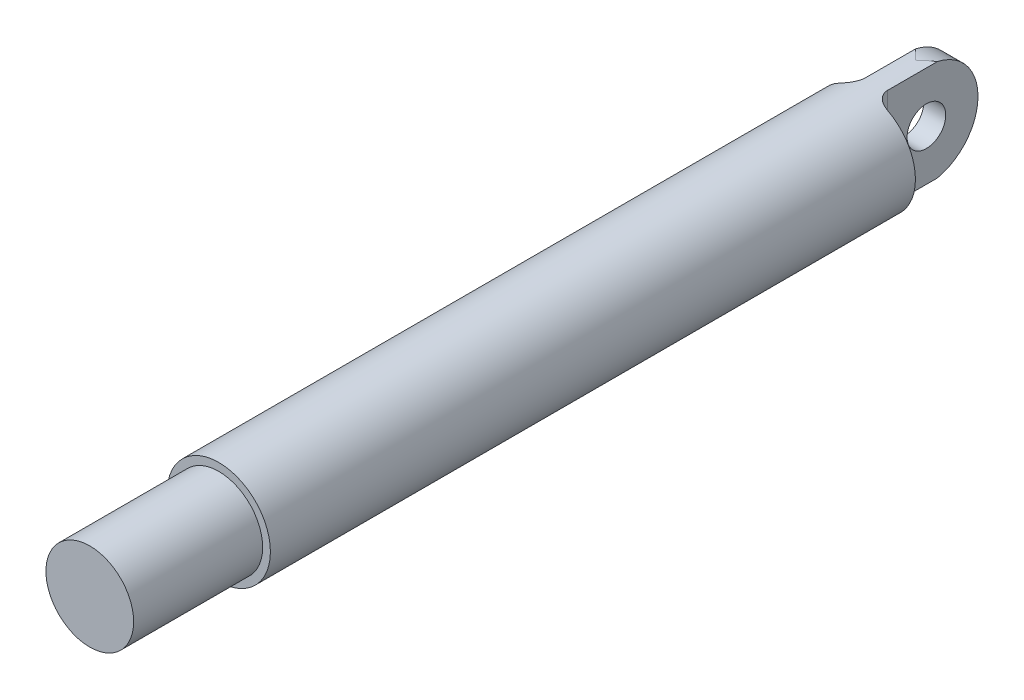
from build123d import *

# Parameters (mm, degrees)
SKETCH5_R               = 20
BOSS_EXTRUDE4_DEPTH     = 250
SKETCH6_R               = 17
BOSS_EXTRUDE5_DEPTH     = 50
SKETCH7_R               = 7.5
BOSS_EXTRUDE6_DEPTH     = 4.25
CUT_EXTRUDE1_DEPTH      = 302.330383466
CUT_EXTRUDE1_DEPTH_BACK = 302.330383466
SKETCH8_OUTSIDE_W       = 110.934
SKETCH8_OUTSIDE_H       = 110.934
SKETCH8_OUTSIDE_R       = 20
FILLET1_R               = 5


with BuildPart() as part:
    # Sketch5 → Boss-Extrude4 (new body)
    with BuildSketch(Plane.XY):
        Circle(SKETCH5_R)
    extrude(amount=-BOSS_EXTRUDE4_DEPTH)

    # Sketch6 → Boss-Extrude5 (add)
    with BuildSketch(Plane.XY):
        Circle(SKETCH6_R)
    extrude(amount=BOSS_EXTRUDE5_DEPTH)

    # Sketch7 → Boss-Extrude6 (add, symmetric)
    with BuildSketch(Plane(origin=(0, 0, 0), x_dir=(0, 0, -1), z_dir=(1, 0, 0))):
        with BuildLine():
            Line((250, 20), (270, 20))
            ThreePointArc((270, 20), (290, 0), (270, -20))
            Line((270, -20), (250, -20))
            Line((250, -20), (250, 20))
        make_face()
        with Locations((270, 0)):
            Circle(SKETCH7_R, mode=Mode.SUBTRACT)
    extrude(amount=BOSS_EXTRUDE6_DEPTH, both=True)

    # Sketch8 outside → Cut-Extrude1 (cut, two sides: drawn at the far end of the back side and taken through both)
    with BuildSketch(Plane(origin=(0, 0, -250), x_dir=(-1, 0, 0), z_dir=(0, 0, -1)).offset(-CUT_EXTRUDE1_DEPTH_BACK)):
        Rectangle(SKETCH8_OUTSIDE_W, SKETCH8_OUTSIDE_H)
        with Locations(Location((0, 0, 0), (0, 0, 180))):
            Circle(SKETCH8_OUTSIDE_R, mode=Mode.SUBTRACT)
    extrude(amount=CUT_EXTRUDE1_DEPTH + CUT_EXTRUDE1_DEPTH_BACK, mode=Mode.SUBTRACT)

    # Fillet1
    fillet1_edges = [part.edges().sort_by_distance(p)[0] for p in [
        (4.25, 0, -250),
        (-4.25, 0, -250),
    ]]
    fillet(fillet1_edges, radius=FILLET1_R)


solid = part.part
